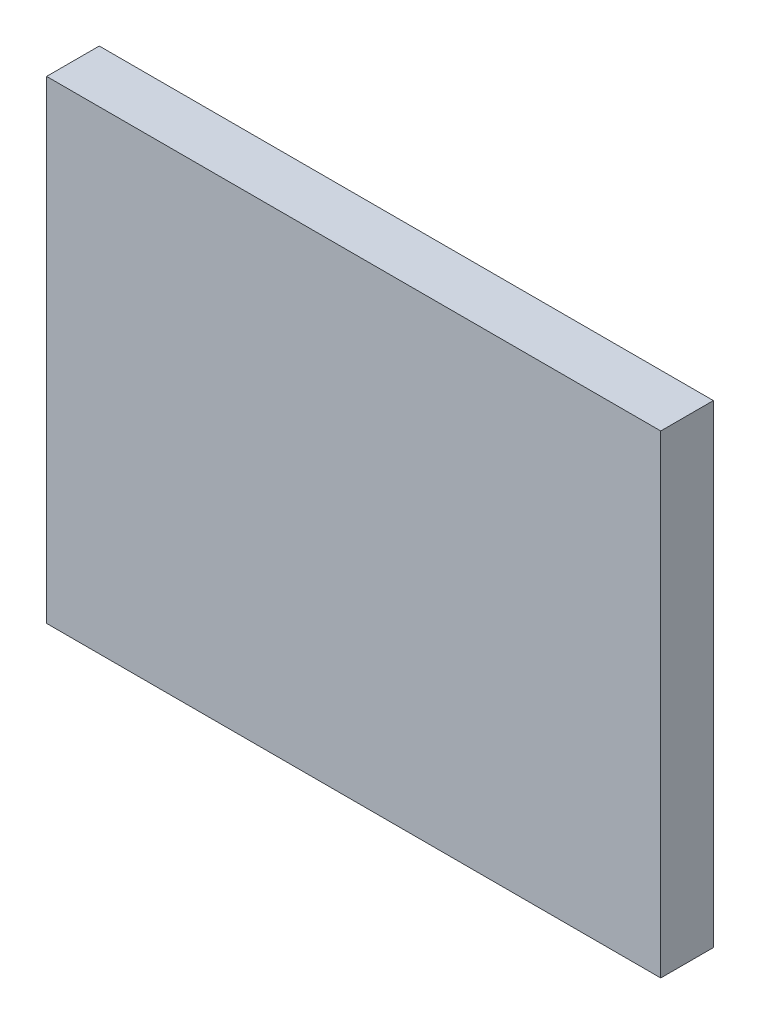
from build123d import *

# Parameters (mm, degrees)
ESQUISSE1_W        = 35
ESQUISSE1_H        = 27
BOSS_EXTRU_1_DEPTH = 3


with BuildPart() as part:
    # Esquisse1 → Boss.-Extru.1 (new body)
    with BuildSketch(Plane.XY):
        Rectangle(ESQUISSE1_W, ESQUISSE1_H)
    extrude(amount=BOSS_EXTRU_1_DEPTH)


solid = part.part
